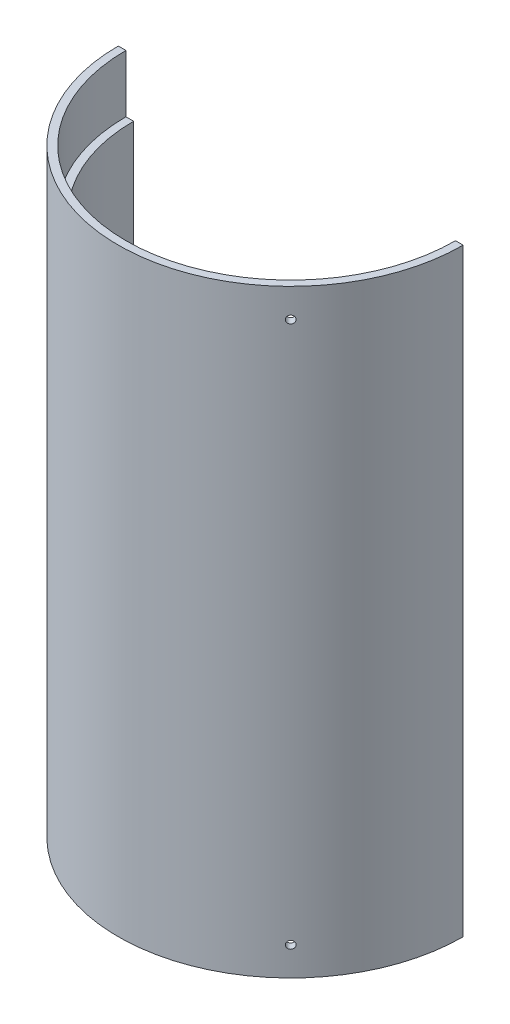
from build123d import *

# Parameters (mm, degrees)
REVOLVE1_ANGLE     = 180
SKETCH2_R          = 10.45
CUT_EXTRUDE1_DEPTH = 169.759266412
SKETCH3_R          = 1
CUT_EXTRUDE2_DEPTH = 169.759266558
CIRPATTERN1_COUNT  = 4


with BuildPart() as part:
    # Sketch1 → Revolve1 (revolve)
    with BuildSketch(Plane.XY):
        Polygon((-45, 0), (-45, 156.3), (-43, 156.3), (-43, 141.3), (-41, 141.3), (-41, 15), (-43, 15), (-43, 0), align=None)
    revolve(axis=Axis((0, 0, 0), (0, 1, 0)), revolution_arc=REVOLVE1_ANGLE)

    # Sketch2 → Cut-Extrude1 (cut, through all)
    with BuildSketch(Plane(origin=(0, 0, 0), x_dir=(0, 0, -1), z_dir=(1, 0, 0))):
        with Locations((0, 40.3)):
            Circle(SKETCH2_R)
        with Locations((0, 91.5)):
            Circle(SKETCH2_R)
    extrude(amount=-CUT_EXTRUDE1_DEPTH, mode=Mode.SUBTRACT)

    # Sketch3 → Cut-Extrude2 (cut, through all)
    with BuildSketch(Plane(origin=(0, 0, 0), x_dir=(0, 1, 0), z_dir=(0.7071067811865464, 0, -0.7071067811865488))):
        with Locations(Location((7.5, 0, 0), (0, 0, 270))):
            Circle(SKETCH3_R)
        with Locations(Location((148.8, 0, 0), (0, 0, 270))):
            Circle(SKETCH3_R)
    cut_extrude2 = extrude(amount=-CUT_EXTRUDE2_DEPTH, mode=Mode.SUBTRACT)

    # CirPattern1: Cut-Extrude2 ×4 about axis
    cirpattern1_axis = Axis((0, 0, 0), (0, -1, 0))
    for i in range(1, CIRPATTERN1_COUNT):
        add(cut_extrude2.rotate(cirpattern1_axis, i * 360 / CIRPATTERN1_COUNT), mode=Mode.SUBTRACT)


solid = part.part
